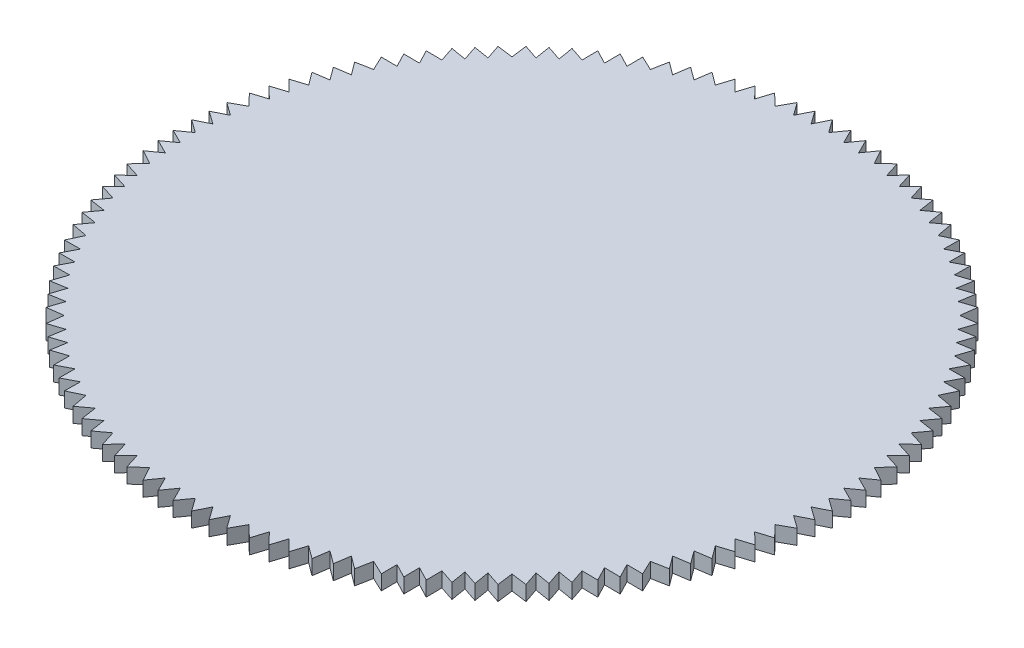
from build123d import *

# Parameters (mm, degrees)
BOSS_EXTRUDE1_DEPTH = 3


with BuildPart() as part:
    # Sketch1 → Boss-Extrude1 (new body)
    with BuildSketch(Plane(origin=(0, 0, 0), x_dir=(1, 0, 0), z_dir=(0, 1, 0))):
        Polygon((22.350624173, 62.76902606), (19.77708764, 60.867617043), (18.812673028, 63.918576071), (16.568266903, 61.637986744), (15.603852291, 64.688945772), (13.359446165, 62.408356444), (12.395031553, 65.459315473), (10.011805763, 63.212053798), (8.439665393, 66.085783929), (6.579654403, 63.482169968), (5.149838191, 66.344698944), (3.289827201, 63.741084984), (1.86001099, 66.60361396), (0, 64), (-1.86001099, 66.60361396), (-3.289827201, 63.741084984), (-5.149838191, 66.344698944), (-6.579654403, 63.482169968), (-8.439665393, 66.085783929), (-10.011805763, 63.212053798), (-12.395031553, 65.459315473), (-13.359446165, 62.408356444), (-15.603852291, 64.688945772), (-16.568266903, 61.637986744), (-18.812673028, 63.918576071), (-19.77708764, 60.867617043), (-22.350624173, 62.76902606), (-22.825890097, 59.604761716), (-25.39942663, 61.506170733), (-25.874692555, 58.341906389), (-28.448229088, 60.243315407), (-29.055391983, 57.024417548), (-32.01641645, 58.425233137), (-31.990831062, 55.225578167), (-34.830128992, 56.700987873), (-34.804543604, 53.501332904), (-37.643841535, 54.97674261), (-37.618256147, 51.77708764), (-40.653402536, 52.790168552), (-40.127595833, 49.633909081), (-43.162742222, 50.646989992), (-42.63693552, 47.490730521), (-45.672081909, 48.503811433), (-45.254833996, 45.254833996), (-48.503811433, 45.672081909), (-47.490730521, 42.63693552), (-50.646989992, 43.162742222), (-49.633909081, 40.127595833), (-52.790168552, 40.653402536), (-51.77708764, 37.618256147), (-54.97674261, 37.643841535), (-53.501332904, 34.804543604), (-56.700987873, 34.830128992), (-55.225578167, 31.990831062), (-58.425233137, 32.01641645), (-57.024417548, 29.055391983), (-60.243315407, 28.448229088), (-58.341906389, 25.874692555), (-61.506170733, 25.39942663), (-59.604761716, 22.825890097), (-62.76902606, 22.350624173), (-60.867617043, 19.77708764), (-63.918576071, 18.812673028), (-61.637986744, 16.568266903), (-64.688945772, 15.603852291), (-62.408356444, 13.359446165), (-65.459315473, 12.395031553), (-63.212053798, 10.011805763), (-66.085783929, 8.439665393), (-63.482169968, 6.579654403), (-66.344698944, 5.149838191), (-63.741084984, 3.289827201), (-66.60361396, 1.86001099), (-64, 0), (-66.60361396, -1.86001099), (-63.741084984, -3.289827201), (-66.344698944, -5.149838191), (-63.482169968, -6.579654403), (-66.085783929, -8.439665393), (-63.212053798, -10.011805763), (-65.459315473, -12.395031553), (-62.408356444, -13.359446165), (-64.688945772, -15.603852291), (-61.637986744, -16.568266903), (-63.918576071, -18.812673028), (-60.867617043, -19.77708764), (-62.76902606, -22.350624173), (-59.604761716, -22.825890097), (-61.506170733, -25.39942663), (-58.341906389, -25.874692555), (-60.243315407, -28.448229088), (-57.024417548, -29.055391983), (-58.425233137, -32.01641645), (-55.225578167, -31.990831062), (-56.700987873, -34.830128992), (-53.501332904, -34.804543604), (-54.97674261, -37.643841535), (-51.77708764, -37.618256147), (-52.790168552, -40.653402536), (-49.63390908, -40.127595833), (-50.646989992, -43.162742222), (-47.490730521, -42.63693552), (-48.503811433, -45.672081909), (-45.254833996, -45.254833996), (-45.672081909, -48.503811433), (-42.63693552, -47.490730521), (-43.162742222, -50.646989992), (-40.127595833, -49.633909081), (-40.653402536, -52.790168552), (-37.618256147, -51.77708764), (-37.643841535, -54.97674261), (-34.804543604, -53.501332904), (-34.830128992, -56.700987873), (-31.990831062, -55.225578167), (-32.01641645, -58.425233137), (-29.055391983, -57.024417548), (-28.448229088, -60.243315407), (-25.874692555, -58.341906389), (-25.39942663, -61.506170733), (-22.825890097, -59.604761716), (-22.350624173, -62.76902606), (-19.77708764, -60.867617043), (-18.812673028, -63.918576071), (-16.568266903, -61.637986744), (-15.603852291, -64.688945772), (-13.359446165, -62.408356444), (-12.395031553, -65.459315473), (-10.011805763, -63.212053798), (-8.439665393, -66.085783929), (-6.579654403, -63.482169968), (-5.149838191, -66.344698944), (-3.289827201, -63.741084984), (-1.86001099, -66.60361396), (0, -64), (1.86001099, -66.60361396), (3.289827201, -63.741084984), (5.149838191, -66.344698944), (6.579654403, -63.482169968), (8.439665393, -66.085783929), (10.011805763, -63.212053798), (12.395031553, -65.459315473), (13.359446165, -62.408356444), (15.603852291, -64.688945772), (16.568266903, -61.637986744), (18.812673028, -63.918576071), (19.77708764, -60.867617043), (22.350624173, -62.76902606), (22.825890097, -59.604761716), (25.39942663, -61.506170733), (25.874692555, -58.341906389), (28.448229088, -60.243315407), (29.055391983, -57.024417548), (32.01641645, -58.425233137), (31.990831062, -55.225578167), (34.830128992, -56.700987873), (34.804543604, -53.501332904), (37.643841535, -54.97674261), (37.618256147, -51.77708764), (40.653402536, -52.790168552), (40.127595833, -49.633909081), (43.162742222, -50.646989992), (42.63693552, -47.490730521), (45.672081909, -48.503811433), (45.254833996, -45.254833996), (48.503811433, -45.672081909), (47.490730521, -42.63693552), (50.646989992, -43.162742222), (49.633909081, -40.127595833), (52.790168552, -40.653402536), (51.77708764, -37.618256147), (54.97674261, -37.643841535), (53.501332904, -34.804543604), (56.700987873, -34.830128992), (55.225578167, -31.990831062), (58.425233137, -32.01641645), (57.024417548, -29.055391983), (60.243315407, -28.448229088), (58.341906389, -25.874692555), (61.506170733, -25.39942663), (59.604761716, -22.825890097), (62.76902606, -22.350624173), (60.867617043, -19.77708764), (63.918576071, -18.812673028), (61.637986744, -16.568266903), (64.688945772, -15.603852291), (62.408356444, -13.359446165), (65.459315473, -12.395031553), (63.212053798, -10.011805763), (66.085783929, -8.439665393), (63.482169968, -6.579654403), (66.344698944, -5.149838191), (63.741084984, -3.289827201), (66.60361396, -1.86001099), (64, 0), (66.60361396, 1.86001099), (63.741084984, 3.289827201), (66.344698944, 5.149838191), (63.482169968, 6.579654403), (66.085783929, 8.439665393), (63.212053798, 10.011805763), (65.459315473, 12.395031553), (62.408356444, 13.359446165), (64.688945772, 15.603852291), (61.637986744, 16.568266903), (63.918576071, 18.812673028), (60.867617043, 19.77708764), (62.76902606, 22.350624173), (59.604761716, 22.825890097), (61.506170733, 25.39942663), (58.341906389, 25.874692555), (60.243315407, 28.448229088), (57.024417548, 29.055391983), (58.425233137, 32.01641645), (55.225578167, 31.990831062), (56.700987873, 34.830128992), (53.501332904, 34.804543604), (54.97674261, 37.643841535), (51.77708764, 37.618256147), (52.790168552, 40.653402536), (49.633909081, 40.127595833), (50.646989992, 43.162742222), (47.490730521, 42.63693552), (48.503811433, 45.672081909), (45.254833996, 45.254833996), (45.672081909, 48.503811433), (42.63693552, 47.490730521), (43.162742222, 50.646989992), (40.127595833, 49.633909081), (40.653402536, 52.790168552), (37.618256147, 51.77708764), (37.643841535, 54.97674261), (34.804543604, 53.501332904), (34.830128992, 56.700987873), (31.990831062, 55.225578167), (32.01641645, 58.425233137), (29.055391983, 57.024417548), (28.448229088, 60.243315407), (25.874692555, 58.341906389), (25.39942663, 61.506170733), (22.825890097, 59.604761716), align=None)
    extrude(amount=BOSS_EXTRUDE1_DEPTH)


solid = part.part
